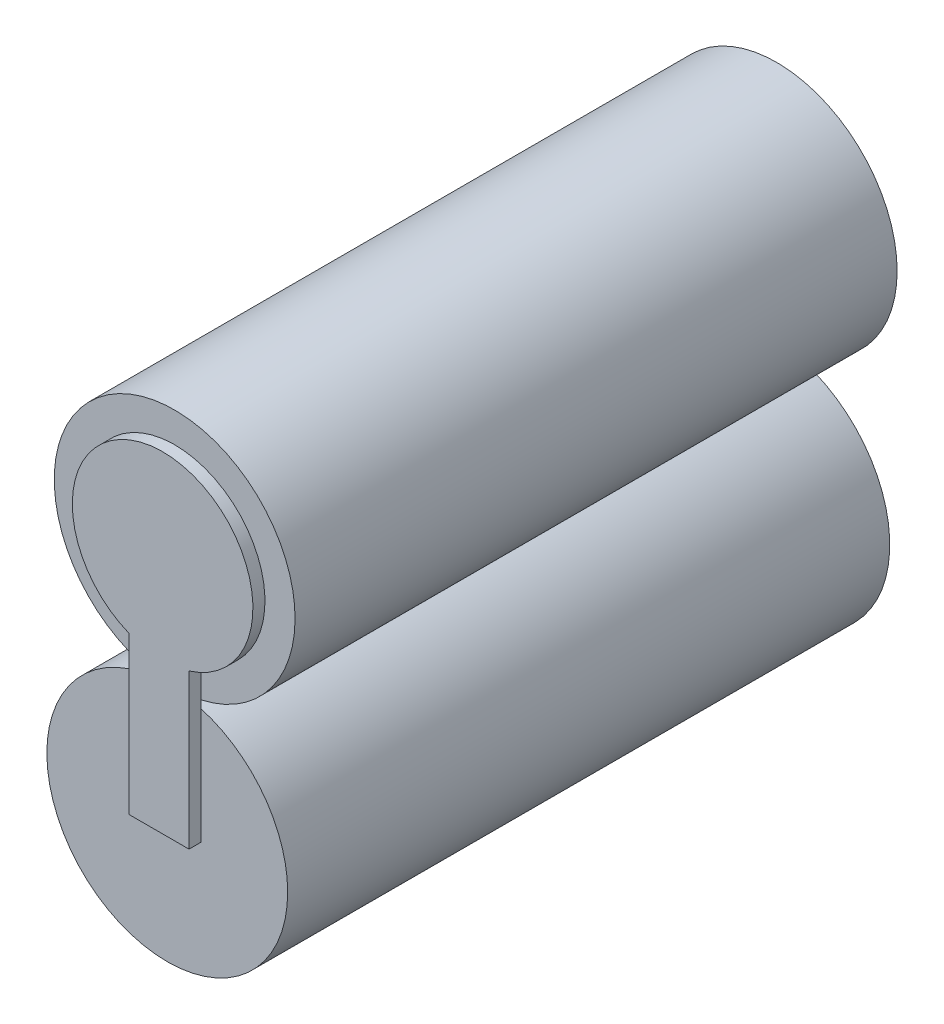
from build123d import *

# Parameters (mm, degrees)
ESBO_O1_R                  = 10
RESSALTO_EXTRUS_O1_DEPTH   = 50
RESSALTO_EXTRUS_O1_2_DEPTH = 50
RESSALTO_EXTRUS_O2_DEPTH   = 1
RESSALTO_EXTRUS_O3_DEPTH   = 1


with BuildPart() as part:
    # Esboço1 → Ressalto-extrusão1 (new body)
    with BuildSketch(Plane.XY):
        with Locations((-67.308878825, 529.696792621)):
            Circle(ESBO_O1_R)
    extrude(amount=RESSALTO_EXTRUS_O1_DEPTH)

    # Esboço2 → Ressalto-extrusão2 (add)
    with BuildSketch(Plane.XY.offset(50)):
        with BuildLine():
            Line((-65.115771676, 522.524604598), (-65.115771676, 509.706502891))
            Line((-65.115771676, 509.706502891), (-70.115771676, 509.706502891))
            Line((-70.115771676, 509.706502891), (-70.115771676, 522.741840965))
            ThreePointArc((-70.115771676, 522.741840965), (-66.983331391, 537.189723881), (-65.115771676, 522.524604598))
        make_face()
    extrude(amount=RESSALTO_EXTRUS_O2_DEPTH)


with BuildPart() as body_2:
    # Esboço1 → Ressalto-extrus_o1 2 (new body)
    with BuildSketch(Plane.XY):
        with Locations((-67.922664527, 509.706213161)):
            Circle(ESBO_O1_R)
    extrude(amount=RESSALTO_EXTRUS_O1_2_DEPTH)

    # Esboço3 → Ressalto-extrusão3 (add)
    with BuildSketch(Plane(origin=(0, 0, 0), x_dir=(-1, 0, 0), z_dir=(0, 0, -1))):
        with BuildLine():
            Line((70.115771676, 516.878401184), (70.115771676, 529.696502891))
            Line((70.115771676, 529.696502891), (65.115771676, 529.696502891))
            Line((65.115771676, 529.696502891), (65.115771676, 516.661164816))
            ThreePointArc((65.115771676, 516.661164816), (68.248211961, 502.213281901), (70.115771676, 516.878401184))
        make_face()
    extrude(amount=RESSALTO_EXTRUS_O3_DEPTH)


solid = Compound([part.part, body_2.part])
